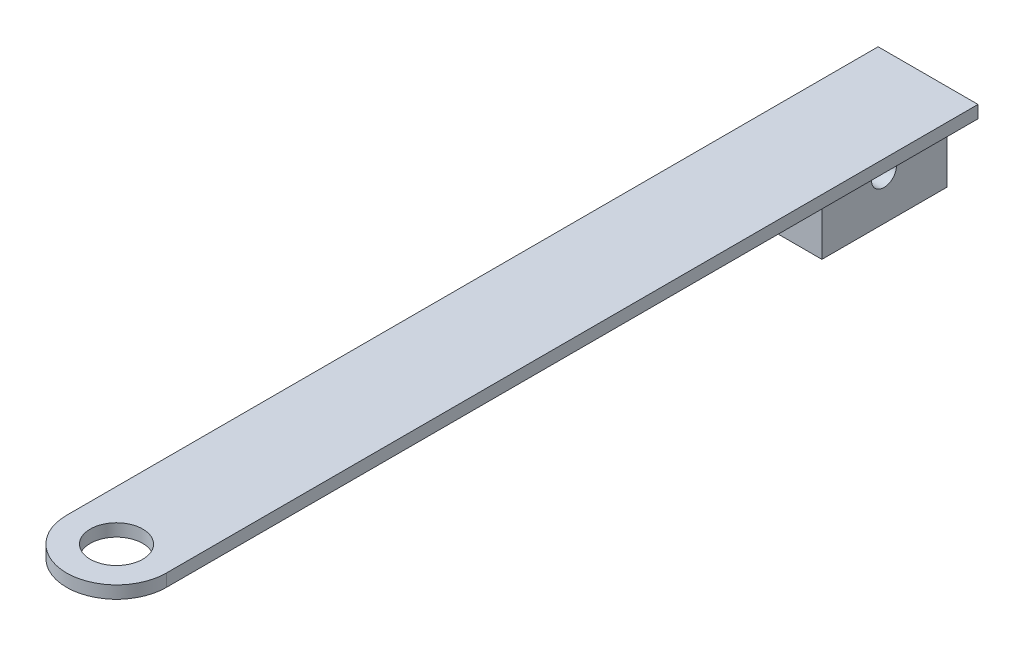
from build123d import *

# Parameters (mm, degrees)
SKETCH1_R           = 5.08
SKETCH1_R_2         = 2.667
BOSS_EXTRUDE1_DEPTH = 1.27
BOSS_EXTRUDE5_DEPTH = 1.27
SKETCH6_W           = 6.985
SKETCH6_H           = 12.7
BOSS_EXTRUDE6_DEPTH = 7.62
CUT_EXTRUDE2_REACH  = 85.195
SKETCH7_R           = 1.27


with BuildPart() as part:
    # Sketch1 → Boss-Extrude1 (new body)
    with BuildSketch(Plane(origin=(0, 0, 0), x_dir=(1, 0, 0), z_dir=(0, 1, 0))):
        with Locations(Location((0, 0, 0), (0, 0, 270))):
            Circle(SKETCH1_R)
        with Locations(Location((0, 0, 0), (0, 0, 270))):
            Circle(SKETCH1_R_2, mode=Mode.SUBTRACT)
    extrude(amount=BOSS_EXTRUDE1_DEPTH)

    # Sketch5 → Boss-Extrude5 (add)
    with BuildSketch(Plane(origin=(0, 0, 0), x_dir=(-1, 0, 0), z_dir=(0, -1, 0))):
        with BuildLine():
            Line((-5.08, 0), (-5.08, 82.55))
            Line((-5.08, 82.55), (5.08, 82.55))
            Line((5.08, 82.55), (5.08, 0))
            ThreePointArc((5.08, 0), (0, 5.08), (-5.08, 0))
        make_face()
    extrude(amount=-BOSS_EXTRUDE5_DEPTH)

    # Sketch6 → Boss-Extrude6 (add)
    with BuildSketch(Plane.XZ):
        with Locations((-1.5875, -76.2)):
            Rectangle(SKETCH6_W, SKETCH6_H)
    extrude(amount=BOSS_EXTRUDE6_DEPTH)

    # Sketch7 → Cut-Extrude2 (cut, up to next)
    with BuildSketch(Plane(origin=(1.905, 0, 0), x_dir=(0, 0, -1), z_dir=(1, 0, 0)), mode=Mode.PRIVATE) as cut_extrude2_sk1:
        with Locations((76.157654901, -3.175)):
            Circle(SKETCH7_R)
    cut_extrude2_tool1 = extrude(cut_extrude2_sk1.sketch, amount=-CUT_EXTRUDE2_REACH, mode=Mode.PRIVATE) & part.part
    add(cut_extrude2_tool1.solids().sort_by_distance((1.905, -3.175, -76.157655))[0], mode=Mode.SUBTRACT)


solid = part.part
